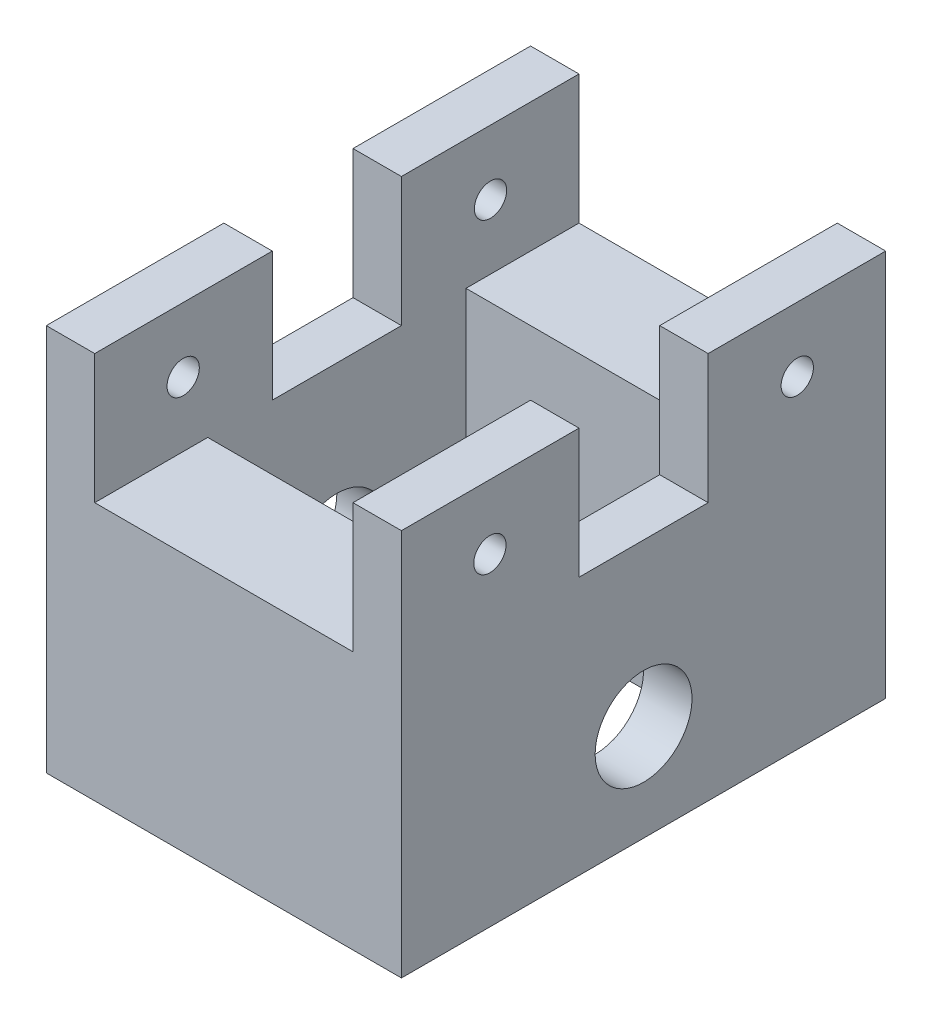
from build123d import *

# Parameters (mm, degrees)
SKETCH1_W               = 139.7
SKETCH1_H               = 190.5
SKETCH1_W_2             = 101.6
SKETCH1_H_2             = 152.4
EXTRUDE_THIN1_DEPTH     = 152.4
CUT_EXTRUDE1_START      = -50.8
SKETCH2_W               = 101.6
SKETCH2_H               = 19.05
CUT_EXTRUDE1_DEPTH      = 50.8
SKETCH5_W               = 101.6
SKETCH5_H               = 50.8
CUT_EXTRUDE5_DEPTH      = 190.5
CUT_EXTRUDE6_DEPTH      = 228.627793777
CUT_EXTRUDE6_DEPTH_BACK = 228.627793777
SKETCH6_R               = 19.05
SKETCH7_R               = 6.35
CUT_EXTRUDE8_DEPTH      = 228.627793777
CUT_EXTRUDE2_START      = -101.6
SKETCH3_W               = 19.05
SKETCH3_H               = 127
CUT_EXTRUDE2_DEPTH      = 101.6
SKETCH4_W               = 367.241731945
SKETCH4_H               = 189.529563026
CUT_EXTRUDE4_DEPTH      = 142.24
SKETCH8_W               = 171.45
SKETCH8_H               = 101.6
BOSS_EXTRUDE1_DEPTH     = 19.05
CUT_EXTRUDE9_DEPTH      = 228.627793777
CUT_EXTRUDE9_DEPTH_BACK = 228.627793777
SKETCH9_R               = 19.05
SKETCH10_W              = 101.6
SKETCH10_H              = 25.4
BOSS_EXTRUDE2_DEPTH     = 101.6
SKETCH11_W              = 139.7
SKETCH11_H              = 50.8
CUT_EXTRUDE10_DEPTH     = 50.8


with BuildPart() as part:
    # Sketch1 → Extrude-Thin1 (new body)
    with BuildSketch(Plane(origin=(0, 0, 0), x_dir=(1, 0, 0), z_dir=(0, 1, 0))):
        Rectangle(SKETCH1_W, SKETCH1_H)
        Rectangle(SKETCH1_W_2, SKETCH1_H_2, mode=Mode.SUBTRACT)
    extrude(amount=EXTRUDE_THIN1_DEPTH)

    # Sketch2 → Cut-Extrude1 (cut)
    with BuildSketch(Plane(origin=(0, 152.4, 0), x_dir=(1, 0, 0), z_dir=(0, 1, 0)).offset(CUT_EXTRUDE1_START)):
        with Locations((0, -85.725)):
            Rectangle(SKETCH2_W, SKETCH2_H)
    extrude(amount=CUT_EXTRUDE1_DEPTH, mode=Mode.SUBTRACT)

    # Sketch5 → Cut-Extrude5 (cut)
    with BuildSketch(Plane.XY.offset(95.25)):
        with Locations((0, 127)):
            Rectangle(SKETCH5_W, SKETCH5_H)
    extrude(amount=-CUT_EXTRUDE5_DEPTH, mode=Mode.SUBTRACT)

    # Sketch6 → Cut-Extrude6 (cut, two sides: drawn at the far end of the back side and taken through both)
    with BuildSketch(Plane.ZY.offset(69.85).offset(-CUT_EXTRUDE6_DEPTH_BACK)):
        with Locations(Location((0, 38.1, 0), (0, 0, 180))):
            Circle(SKETCH6_R)
    extrude(amount=CUT_EXTRUDE6_DEPTH + CUT_EXTRUDE6_DEPTH_BACK, mode=Mode.SUBTRACT)

    # Sketch7 → Cut-Extrude8 (cut, through all)
    with BuildSketch(Plane(origin=(69.85, 0, 0), x_dir=(0, 0, -1), z_dir=(1, 0, 0))):
        with Locations((-60.452, 127)):
            Circle(SKETCH7_R)
        with Locations((60.452, 127)):
            Circle(SKETCH7_R)
    extrude(amount=-CUT_EXTRUDE8_DEPTH, mode=Mode.SUBTRACT)

    # Sketch3 → Cut-Extrude2 (cut)
    with BuildSketch(Plane.XZ.offset(CUT_EXTRUDE2_START)):
        with Locations((-60.325, 12.7)):
            Rectangle(SKETCH3_W, SKETCH3_H)
    extrude(amount=CUT_EXTRUDE2_DEPTH, mode=Mode.SUBTRACT)


with BuildPart() as body_2:
    # Mirror2: mirrored copy
    add(part.part.mirror(Plane(origin=(72.39, 0, 0), x_dir=(0, 0, 1), z_dir=(1, 0, 0))))

    # Sketch4 → Cut-Extrude4 (cut)
    with BuildSketch(Plane(origin=(72.39, 0, 0), x_dir=(0, 0, -1), z_dir=(1, 0, 0))):
        with Locations((39.035224398, 57.635218487)):
            Rectangle(SKETCH4_W, SKETCH4_H)
    extrude(amount=CUT_EXTRUDE4_DEPTH, mode=Mode.SUBTRACT)


with BuildPart() as part_1:
    add(part.part)

    # Sketch8 → Boss-Extrude1 (add)
    with BuildSketch(Plane.ZY.offset(69.85)):
        with Locations((-9.525, 50.8)):
            Rectangle(SKETCH8_W, SKETCH8_H)
    extrude(amount=-BOSS_EXTRUDE1_DEPTH)

    # Sketch9 → Cut-Extrude9 (cut, two sides: drawn at the far end of the back side and taken through both)
    with BuildSketch(Plane(origin=(69.85, 0, 0), x_dir=(0, 0, -1), z_dir=(1, 0, 0)).offset(-CUT_EXTRUDE9_DEPTH_BACK)):
        with Locations(Location((0, 38.1, 0), (0, 0, 180))):
            Circle(SKETCH9_R)
    extrude(amount=CUT_EXTRUDE9_DEPTH + CUT_EXTRUDE9_DEPTH_BACK, mode=Mode.SUBTRACT)

    # Sketch10 → Boss-Extrude2 (add)
    with BuildSketch(Plane.XZ):
        with Locations((0, -63.5)):
            Rectangle(SKETCH10_W, SKETCH10_H)
        with Locations((0, 63.5)):
            Rectangle(SKETCH10_W, SKETCH10_H)
    extrude(amount=-BOSS_EXTRUDE2_DEPTH)

    # Sketch11 → Cut-Extrude10 (cut)
    with BuildSketch(Plane(origin=(0, 152.4, 0), x_dir=(1, 0, 0), z_dir=(0, 1, 0))):
        Rectangle(SKETCH11_W, SKETCH11_H)
    extrude(amount=-CUT_EXTRUDE10_DEPTH, mode=Mode.SUBTRACT)


solid = part_1.part
